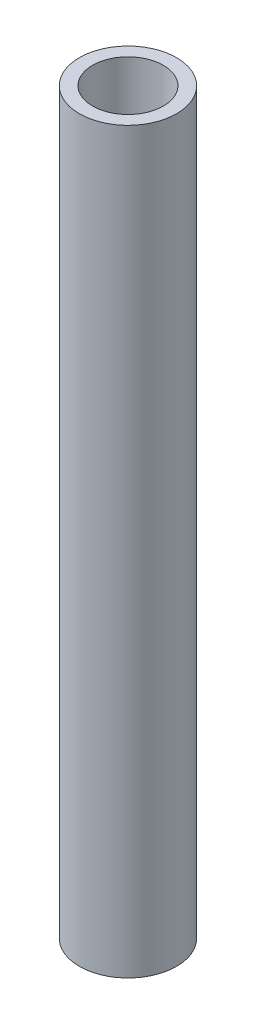
from build123d import *

# Parameters (mm, degrees)
SKETCH1_R           = 16.7132
SKETCH1_R_2         = 12.1666
BOSS_EXTRUDE1_DEPTH = 127


with BuildPart() as part:
    # Sketch1 → Boss-Extrude1 (new, symmetric)
    with BuildSketch(Plane(origin=(0, 0, 0), x_dir=(1, 0, 0), z_dir=(0, 1, 0))):
        with Locations(Location((0, 0, 0), (0, 0, 270))):
            Circle(SKETCH1_R)
        with Locations(Location((0, 0, 0), (0, 0, 270))):
            Circle(SKETCH1_R_2, mode=Mode.SUBTRACT)
    extrude(amount=BOSS_EXTRUDE1_DEPTH, both=True)


solid = part.part
